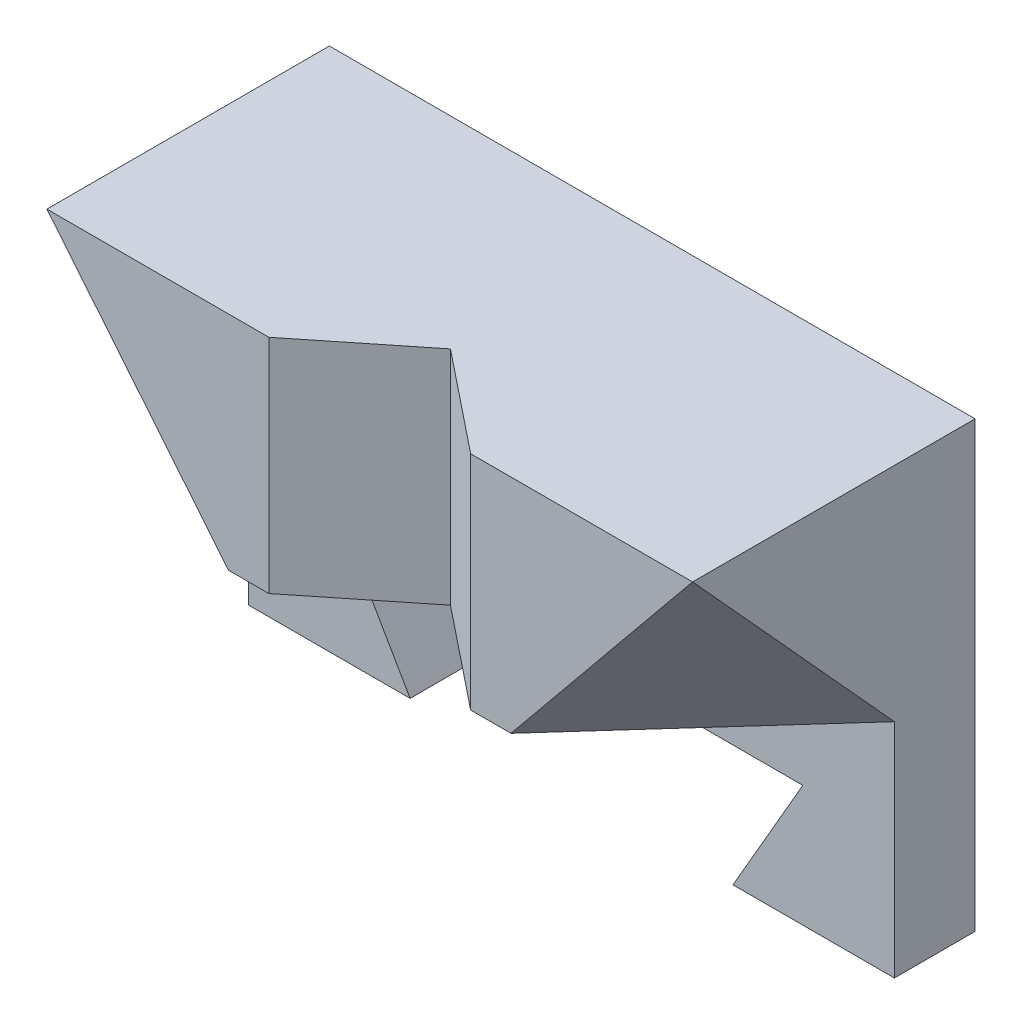
from build123d import *

# Parameters (mm, degrees)
SKETCH_1_W               = 64
SKETCH_1_H               = 44
EXTRUDE_1_DEPTH          = 8
EXTRUDE_2_DEPTH          = 20
CUT_EXTRUDE_1_DEPTH      = 20
CUT_EXTRUDE_2_DEPTH      = 29
CUT_EXTRUDE_3_DEPTH      = 29
CUT_EXTRUDE_3_DEPTH_BACK = 29
CUT_EXTRUDE_4_DEPTH      = 29
CUT_EXTRUDE_4_DEPTH_BACK = 29


with BuildPart() as part:
    # 草图1 → 凸台-拉伸1 (new body)
    with BuildSketch(Plane.XY):
        Rectangle(SKETCH_1_W, SKETCH_1_H)
    extrude(amount=-EXTRUDE_1_DEPTH)

    # 草图2 → 凸台-拉伸2 (add)
    with BuildSketch(Plane.XY):
        Polygon((0, 0), (-32, 0), (-32, 22), (32, 22), (32, 0), align=None)
    extrude(amount=EXTRUDE_2_DEPTH)

    # 草图3 → 切除-拉伸1 (cut)
    with BuildSketch(Plane.XY):
        Polygon((0, -22), (-16, -22), (-22.92820323, -10), (22.92820323, -10), (16, -22), align=None)
    extrude(amount=-CUT_EXTRUDE_1_DEPTH, mode=Mode.SUBTRACT)

    # 草图4 → 切除-拉伸2 (cut)
    with BuildSketch(Plane.XZ):
        Polygon((0, 20), (-10, 20), (0, 12), (10, 20), align=None)
    extrude(amount=-CUT_EXTRUDE_2_DEPTH, mode=Mode.SUBTRACT)

    # 草图7 → 切除-拉伸3 (cut, two sides: drawn at the far end of the back side and taken through both)
    with BuildSketch(Plane(origin=(-32, 0, 20), x_dir=(0.7739572992033211, 0.6332377902572627, 0), z_dir=(-0.6332377902572627, 0.7739572992033211, 0)).offset(-CUT_EXTRUDE_3_DEPTH_BACK)):
        Polygon((0, 20), (13.931231386, 0), (0, 0), align=None)
    extrude(amount=CUT_EXTRUDE_3_DEPTH + CUT_EXTRUDE_3_DEPTH_BACK, mode=Mode.SUBTRACT)

    # 草图8 → 切除-拉伸4 (cut, two sides: drawn at the far end of the back side and taken through both)
    with BuildSketch(Plane(origin=(32, 0, 20), x_dir=(0.7739572992033212, -0.6332377902572625, 0), z_dir=(0.6332377902572625, 0.7739572992033212, 0)).offset(-CUT_EXTRUDE_4_DEPTH_BACK)):
        Polygon((0, 20), (0, 0), (-13.931231386, 0), align=None)
    extrude(amount=CUT_EXTRUDE_4_DEPTH + CUT_EXTRUDE_4_DEPTH_BACK, mode=Mode.SUBTRACT)


solid = part.part
